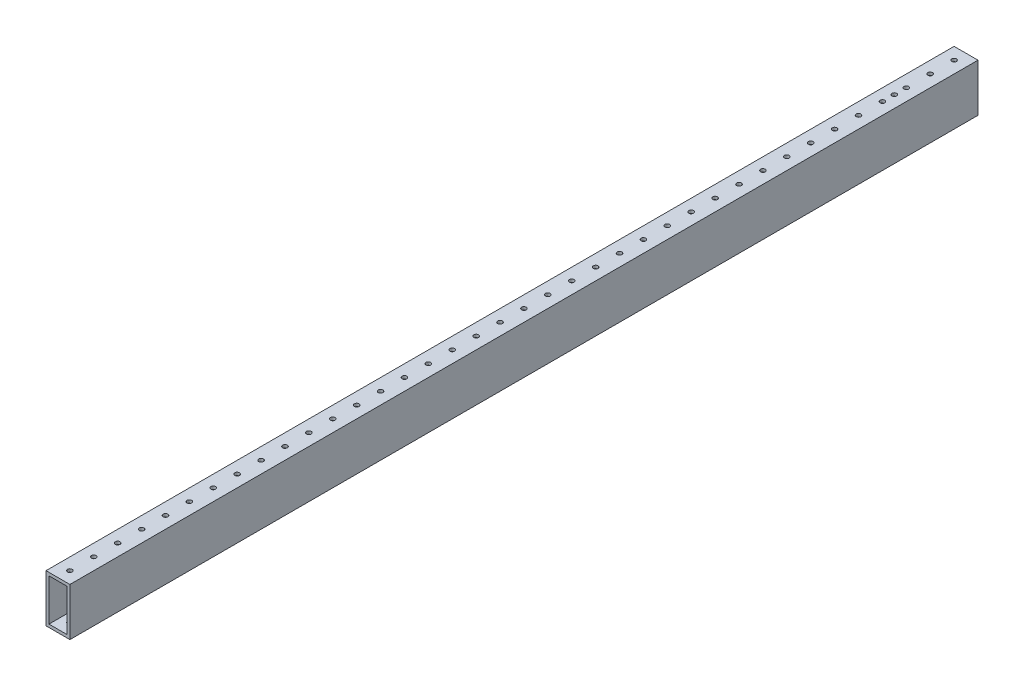
from build123d import *

# Parameters (mm, degrees)
SKETCH1_W           = 25.4
SKETCH1_H           = 50.8
SKETCH1_W_2         = 19.05
SKETCH1_H_2         = 44.45
BOSS_EXTRUDE1_DEPTH = 965.2
SKETCH2_R           = 2.4892
CUT_EXTRUDE1_DEPTH  = 967.619351141


with BuildPart() as part:
    # Sketch1 → Boss-Extrude1 (new body)
    with BuildSketch(Plane.XY):
        Rectangle(SKETCH1_W, SKETCH1_H)
        Rectangle(SKETCH1_W_2, SKETCH1_H_2, mode=Mode.SUBTRACT)
    extrude(amount=BOSS_EXTRUDE1_DEPTH)

    # Sketch2 → Cut-Extrude1 (cut, through all)
    with BuildSketch(Plane(origin=(0, 25.4, 0), x_dir=(1, 0, 0), z_dir=(0, 1, 0))):
        with Locations(Location((0, -12.7, 0), (0, 0, 270))):
            Circle(SKETCH2_R)
        with Locations(Location((0, -38.1, 0), (0, 0, 270))):
            Circle(SKETCH2_R)
        with Locations(Location((0, -63.5, 0), (0, 0, 270))):
            Circle(SKETCH2_R)
        with Locations(Location((0, -88.9, 0), (0, 0, 270))):
            Circle(SKETCH2_R)
        with Locations(Location((0, -114.3, 0), (0, 0, 270))):
            Circle(SKETCH2_R)
        with Locations(Location((0, -139.7, 0), (0, 0, 270))):
            Circle(SKETCH2_R)
        with Locations(Location((0, -165.1, 0), (0, 0, 270))):
            Circle(SKETCH2_R)
        with Locations(Location((0, -190.5, 0), (0, 0, 270))):
            Circle(SKETCH2_R)
        with Locations(Location((0, -215.9, 0), (0, 0, 270))):
            Circle(SKETCH2_R)
        with Locations(Location((0, -241.3, 0), (0, 0, 270))):
            Circle(SKETCH2_R)
        with Locations(Location((0, -266.7, 0), (0, 0, 270))):
            Circle(SKETCH2_R)
        with Locations(Location((0, -292.1, 0), (0, 0, 270))):
            Circle(SKETCH2_R)
        with Locations(Location((0, -317.5, 0), (0, 0, 270))):
            Circle(SKETCH2_R)
        with Locations(Location((0, -342.9, 0), (0, 0, 270))):
            Circle(SKETCH2_R)
        with Locations(Location((0, -368.3, 0), (0, 0, 270))):
            Circle(SKETCH2_R)
        with Locations(Location((0, -393.7, 0), (0, 0, 270))):
            Circle(SKETCH2_R)
        with Locations(Location((0, -419.1, 0), (0, 0, 270))):
            Circle(SKETCH2_R)
        with Locations(Location((0, -444.5, 0), (0, 0, 270))):
            Circle(SKETCH2_R)
        with Locations(Location((0, -469.9, 0), (0, 0, 270))):
            Circle(SKETCH2_R)
        with Locations(Location((0, -495.3, 0), (0, 0, 270))):
            Circle(SKETCH2_R)
        with Locations(Location((0, -520.7, 0), (0, 0, 270))):
            Circle(SKETCH2_R)
        with Locations(Location((0, -546.1, 0), (0, 0, 270))):
            Circle(SKETCH2_R)
        with Locations(Location((0, -571.5, 0), (0, 0, 270))):
            Circle(SKETCH2_R)
        with Locations(Location((0, -596.9, 0), (0, 0, 270))):
            Circle(SKETCH2_R)
        with Locations(Location((0, -622.3, 0), (0, 0, 270))):
            Circle(SKETCH2_R)
        with Locations(Location((0, -647.7, 0), (0, 0, 270))):
            Circle(SKETCH2_R)
        with Locations(Location((0, -673.1, 0), (0, 0, 270))):
            Circle(SKETCH2_R)
        with Locations(Location((0, -698.5, 0), (0, 0, 270))):
            Circle(SKETCH2_R)
        with Locations(Location((0, -723.9, 0), (0, 0, 270))):
            Circle(SKETCH2_R)
        with Locations(Location((0, -749.3, 0), (0, 0, 270))):
            Circle(SKETCH2_R)
        with Locations(Location((0, -774.7, 0), (0, 0, 270))):
            Circle(SKETCH2_R)
        with Locations(Location((0, -800.1, 0), (0, 0, 270))):
            Circle(SKETCH2_R)
        with Locations(Location((0, -825.5, 0), (0, 0, 270))):
            Circle(SKETCH2_R)
        with Locations(Location((0, -850.9, 0), (0, 0, 270))):
            Circle(SKETCH2_R)
        with Locations(Location((0, -876.3, 0), (0, 0, 270))):
            Circle(SKETCH2_R)
        with Locations(Location((0, -901.7, 0), (0, 0, 270))):
            Circle(SKETCH2_R)
        with Locations(Location((0, -927.1, 0), (0, 0, 270))):
            Circle(SKETCH2_R)
        with Locations(Location((0, -952.5, 0), (0, 0, 270))):
            Circle(SKETCH2_R)
        with Locations(Location((0, -76.2, 0), (0, 0, 270))):
            Circle(SKETCH2_R)
    extrude(amount=-CUT_EXTRUDE1_DEPTH, mode=Mode.SUBTRACT)


solid = part.part
